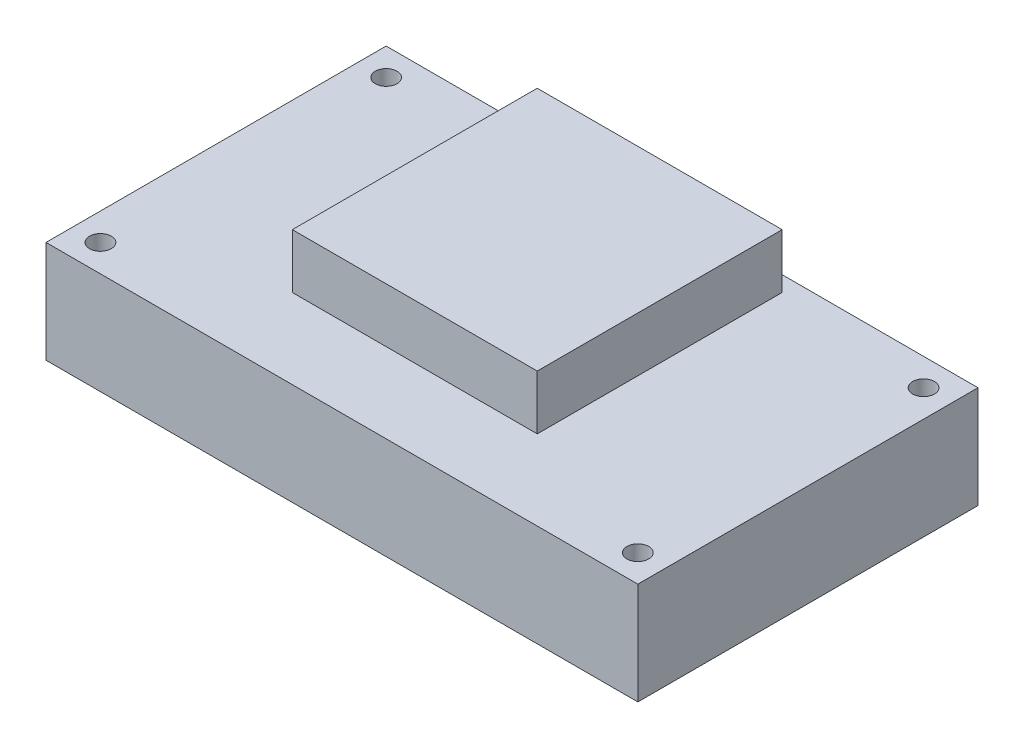
from build123d import *

# Parameters (mm, degrees)
SKETCH_1_W      = 87
SKETCH_1_H      = 50
SKETCH_1_R      = 1.6
EXTRUDE_1_DEPTH = 15
SKETCH_2_W      = 36
SKETCH_2_H      = 36
EXTRUDE_2_DEPTH = 8


with BuildPart() as part:
    # 草图1 → 凸台-拉伸1 (new body)
    with BuildSketch(Plane(origin=(0, 0, 0), x_dir=(1, 0, 0), z_dir=(0, 1, 0))):
        Rectangle(SKETCH_1_W, SKETCH_1_H)
        with Locations(Location((-39.5, 21, 0), (0, 0, 270))):
            Circle(SKETCH_1_R, mode=Mode.SUBTRACT)
        with Locations(Location((39.5, 21, 0), (0, 0, 90))):
            Circle(SKETCH_1_R, mode=Mode.SUBTRACT)
        with Locations(Location((39.5, -21, 0), (0, 0, 270))):
            Circle(SKETCH_1_R, mode=Mode.SUBTRACT)
        with Locations(Location((-39.5, -21, 0), (0, 0, 90))):
            Circle(SKETCH_1_R, mode=Mode.SUBTRACT)
    extrude(amount=EXTRUDE_1_DEPTH)

    # 草图2 → 凸台-拉伸2 (add)
    with BuildSketch(Plane(origin=(0, 15, 0), x_dir=(1, 0, 0), z_dir=(0, 1, 0))):
        with Locations((-1.022681739, 4.732356083)):
            Rectangle(SKETCH_2_W, SKETCH_2_H)
    extrude(amount=EXTRUDE_2_DEPTH)


solid = part.part
